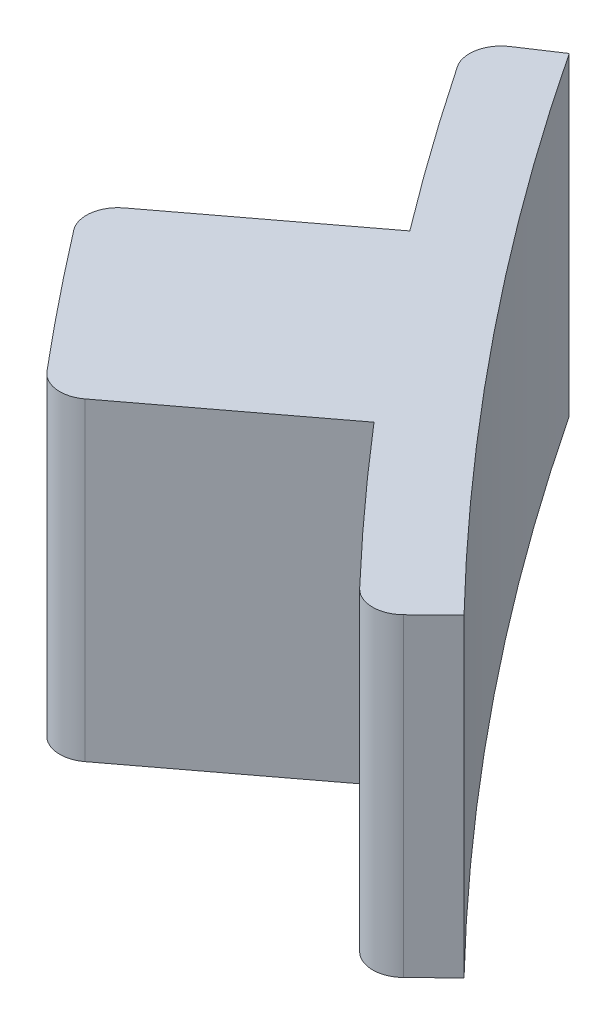
from build123d import *

# Parameters (mm, degrees)
BOSS_EXTRUDE1_DEPTH = 25.4
FILLET1_R           = 2.54


with BuildPart() as part:
    # Sketch1 → Boss-Extrude1 (new body)
    with BuildSketch(Plane(origin=(0, 0, 0), x_dir=(1, 0, 0), z_dir=(0, 1, 0))):
        with BuildLine():
            Line((-244.848924974, -184.847069368), (-240.047965661, -181.222617027))
            ThreePointArc((-240.047965661, -181.222617027), (-245.557867235, -173.683610566), (-250.831084415, -165.977196721))
            Line((-250.831084415, -165.977196721), (-255.847706103, -169.296740655))
            ThreePointArc((-255.847706103, -169.296740655), (-250.469024579, -177.157282777), (-244.848924974, -184.847069368))
        make_face()
        with BuildLine():
            ThreePointArc((-215.750093665, -209.562782535), (-228.339131483, -195.770027771), (-240.047965661, -181.222617027))
            Line((-240.047965661, -181.222617027), (-244.848924974, -184.847069368))
            ThreePointArc((-244.848924974, -184.847069368), (-238.99238799, -192.359230601), (-232.905461186, -199.685956603))
            ThreePointArc((-232.905461186, -199.685956603), (-226.594481496, -206.819670414), (-220.065095538, -213.754038186))
            Line((-220.065095538, -213.754038186), (-215.750093665, -209.562782535))
        make_face()
        with BuildLine():
            ThreePointArc((-232.905461186, -199.685956603), (-238.99238799, -192.359230601), (-244.848924974, -184.847069368))
            Line((-244.848924974, -184.847069368), (-260.051962799, -196.32450178))
            ThreePointArc((-260.051962799, -196.32450178), (-254.20265496, -203.841466748), (-248.136139057, -211.184255684))
            Line((-248.136139057, -211.184255684), (-232.905461186, -199.685956603))
        make_face()
    extrude(amount=BOSS_EXTRUDE1_DEPTH)

    # Fillet1
    fillet1_edges = [part.edges().sort_by_distance(p)[0] for p in [
        (-220.065095538, 12.7, 213.754038186),
        (-248.136139057, 12.7, 211.184255684),
        (-260.051962799, 12.7, 196.32450178),
        (-255.847706103, 12.7, 169.296740655),
    ]]
    fillet(fillet1_edges, radius=FILLET1_R)


solid = part.part
